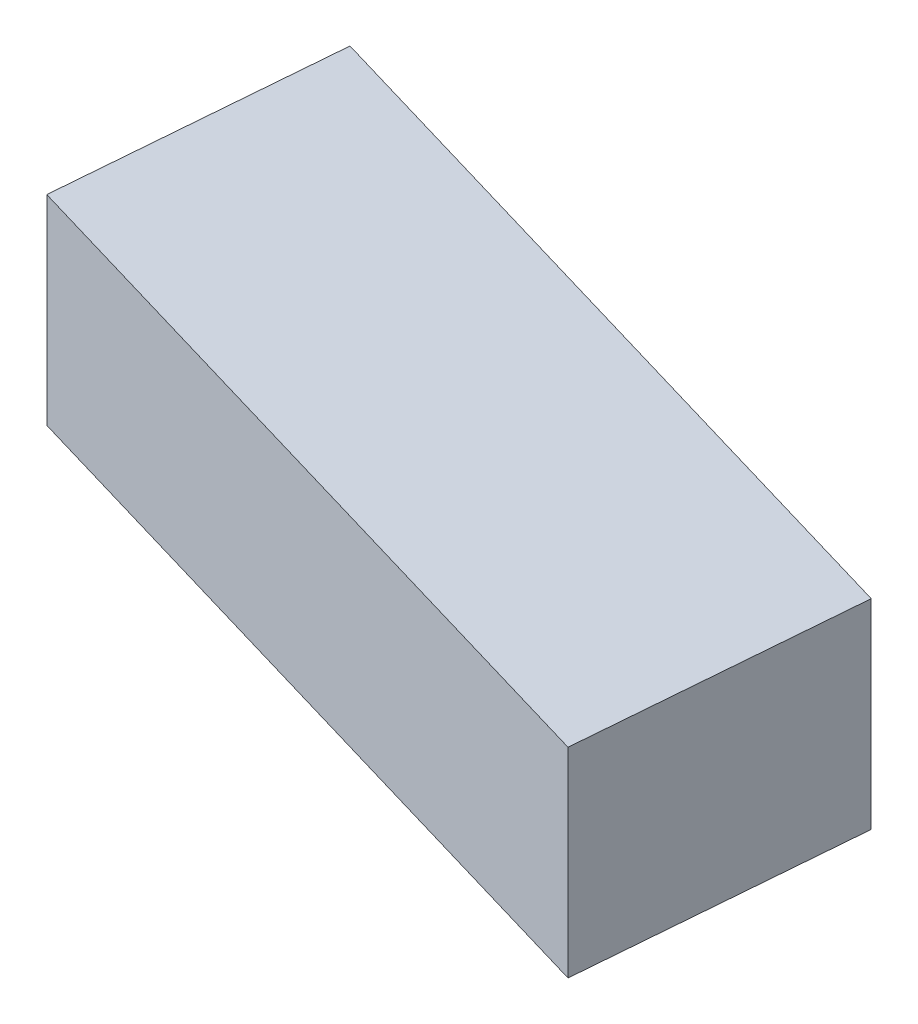
from build123d import *

# Parameters (mm, degrees)
BOSS_EXTRUDE2_DEPTH = 32.766


with BuildPart() as part:
    # Sketch2 → Boss-Extrude2 (new body)
    with BuildSketch(Plane(origin=(0, 0, 0), x_dir=(1, 0, 0), z_dir=(0, 1, 0))):
        Polygon((-68.649872331, 31.037950708), (-72.412048175, -14.91433995), (48.78375935, -50.655010462), (52.545935194, -4.702719804), align=None)
    extrude(amount=BOSS_EXTRUDE2_DEPTH)


solid = part.part
